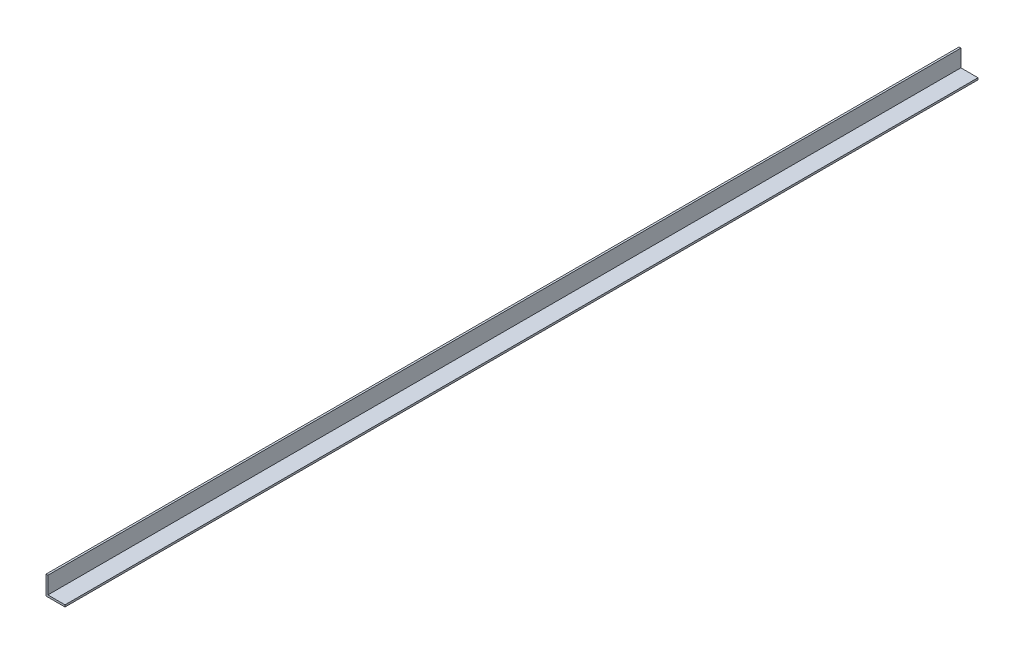
from build123d import *

# Parameters (mm, degrees)
SALIENTE_EXTRUIR1_DEPTH = 6100


with BuildPart() as part:
    # Croquis1 → Saliente-Extruir1 (new body)
    with BuildSketch(Plane.XY):
        Polygon((0, 127), (0, 0), (127, 0), (127, 12.7), (12.7, 12.7), (12.7, 127), align=None)
    extrude(amount=-SALIENTE_EXTRUIR1_DEPTH)


solid = part.part
